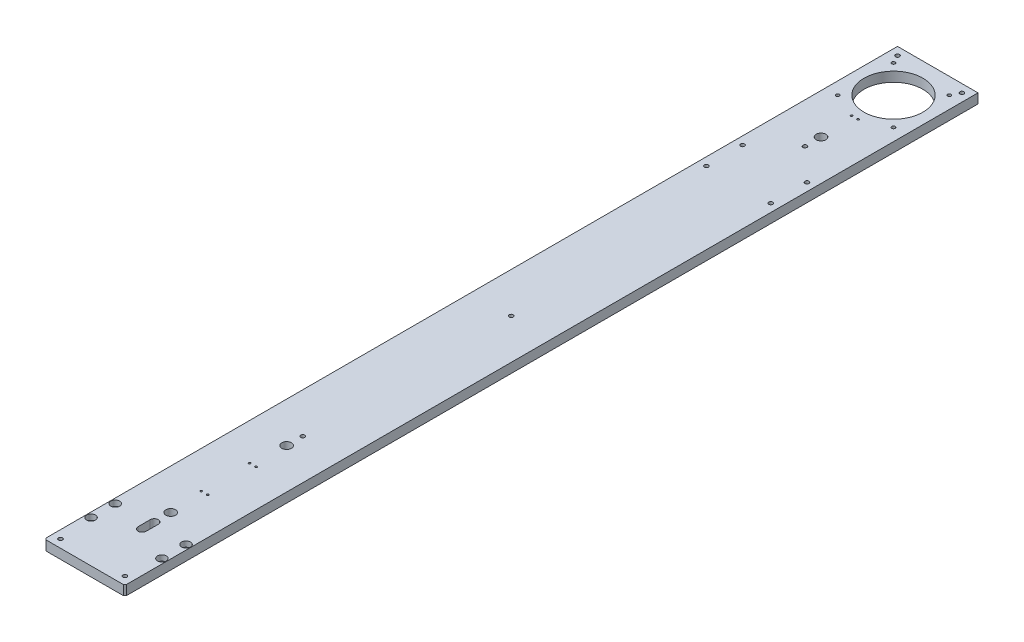
from build123d import *

# Parameters (mm, degrees)
SKETCH_1_W                = 100
SKETCH_1_H                = 1060
EXTRUDE_1_DEPTH           = 12
SKETCH_2_R                = 36.6
CUT_EXTRUDE_1_DEPTH       = 533.488497528
HOLE_WIZARD_M5_1_D        = 4.2
HOLE_WIZARD_M6_1_D        = 5
HOLE_WIZARD_1_D           = 6.6
HOLE_WIZARD_1_CBORE_D     = 11
HOLE_WIZARD_1_CBORE_DEPTH = 6.8
HOLE_WIZARD_M3_1_D        = 2.5
HOLE_WIZARD_M3_1_DEPTH    = 7.5
HOLE_WIZARD_M3_1_TIP      = 0.751075774
HOLE_WIZARD_1_2_D         = 12
HOLE_WIZARD_M6_2_D        = 5
CHAMFER_1_SIZE            = 2


with BuildPart() as part:
    # 草图1 → 凸台-拉伸1 (new body)
    with BuildSketch(Plane(origin=(0, 0, 0), x_dir=(1, 0, 0), z_dir=(0, 1, 0))):
        Rectangle(SKETCH_1_W, SKETCH_1_H)
    extrude(amount=EXTRUDE_1_DEPTH)

    # 草图2 → 切除-拉伸1 (cut, through all)
    with BuildSketch(Plane(origin=(0, 12, 0), x_dir=(1, 0, 0), z_dir=(0, 1, 0))):
        with Locations(Location((0, 475, 0), (0, 0, 270))):
            Circle(SKETCH_2_R)
        with BuildLine():
            Line((5, -443.5), (5, -458.5))
            ThreePointArc((5, -458.5), (0, -463.5), (-5, -458.5))
            Line((-5, -458.5), (-5, -443.5))
            ThreePointArc((-5, -443.5), (0, -438.5), (5, -443.5))
        make_face()
    extrude(amount=-CUT_EXTRUDE_1_DEPTH, mode=Mode.SUBTRACT)

    # M5 螺纹孔1 (through all)
    with Locations(Plane(origin=(0, 12, 0), x_dir=(1, 0, 0), z_dir=(0, 1, 0))):
        with Locations((-34.7, 509.7), (34.7, 509.7), (34.7, 440.3), (-34.7, 440.3)):
            Hole(HOLE_WIZARD_M5_1_D / 2)

    # M6 螺纹孔1 (through all)
    with Locations(Plane(origin=(0, 12, 0), x_dir=(1, 0, 0), z_dir=(0, 1, 0))):
        with Locations((-40, 327.5), (-40, 282.5), (40, 282.5), (40, 327.5)):
            Hole(HOLE_WIZARD_M6_1_D / 2)

    # Hole Wizard 1 (through all)
    with Locations(Plane(origin=(0, 12, 0), x_dir=(1, 0, 0), z_dir=(0, 1, 0))):
        with Locations((-44, -448), (-44, -478), (44, -478), (44, -448)):
            CounterBoreHole(HOLE_WIZARD_1_D / 2, HOLE_WIZARD_1_CBORE_D / 2, HOLE_WIZARD_1_CBORE_DEPTH)

    # M3 螺纹孔1
    with Locations(Plane(origin=(0, 12, 0), x_dir=(1, 0, 0), z_dir=(0, 1, 0))):
        with Locations((-4, -381), (-4, -321), (-4, 427), (4, 427), (4, -321), (4, -381)):
            Hole(HOLE_WIZARD_M3_1_D / 2, depth=HOLE_WIZARD_M3_1_DEPTH)
            with Locations((0, 0, -(HOLE_WIZARD_M3_1_DEPTH + HOLE_WIZARD_M3_1_TIP / 2))):  # 118° drill point
                Cone(0, HOLE_WIZARD_M3_1_D / 2, HOLE_WIZARD_M3_1_TIP, mode=Mode.SUBTRACT)

    # Hole Wizard 1 2 (through all)
    with Locations(Plane(origin=(0, 12, 0), x_dir=(1, 0, 0), z_dir=(0, 1, 0))):
        with Locations((0, 385), (0, -279), (0, -423)):
            Hole(HOLE_WIZARD_1_2_D / 2)

    # M6 螺纹孔2 (through all)
    with Locations(Plane(origin=(0, 12, 0), x_dir=(1, 0, 0), z_dir=(0, 1, 0))):
        with Locations((-40, 520), (40, 520), (40, -520), (-40, -520), (0, 365), (0, 0), (0, -259)):
            Hole(HOLE_WIZARD_M6_2_D / 2)

    # 倒角1
    chamfer_1_edges = [part.edges().sort_by_distance(p)[0] for p in [
        (50, 6, 530),
        (-50, 6, 530),
    ]]
    chamfer(chamfer_1_edges, length=CHAMFER_1_SIZE)


solid = part.part
